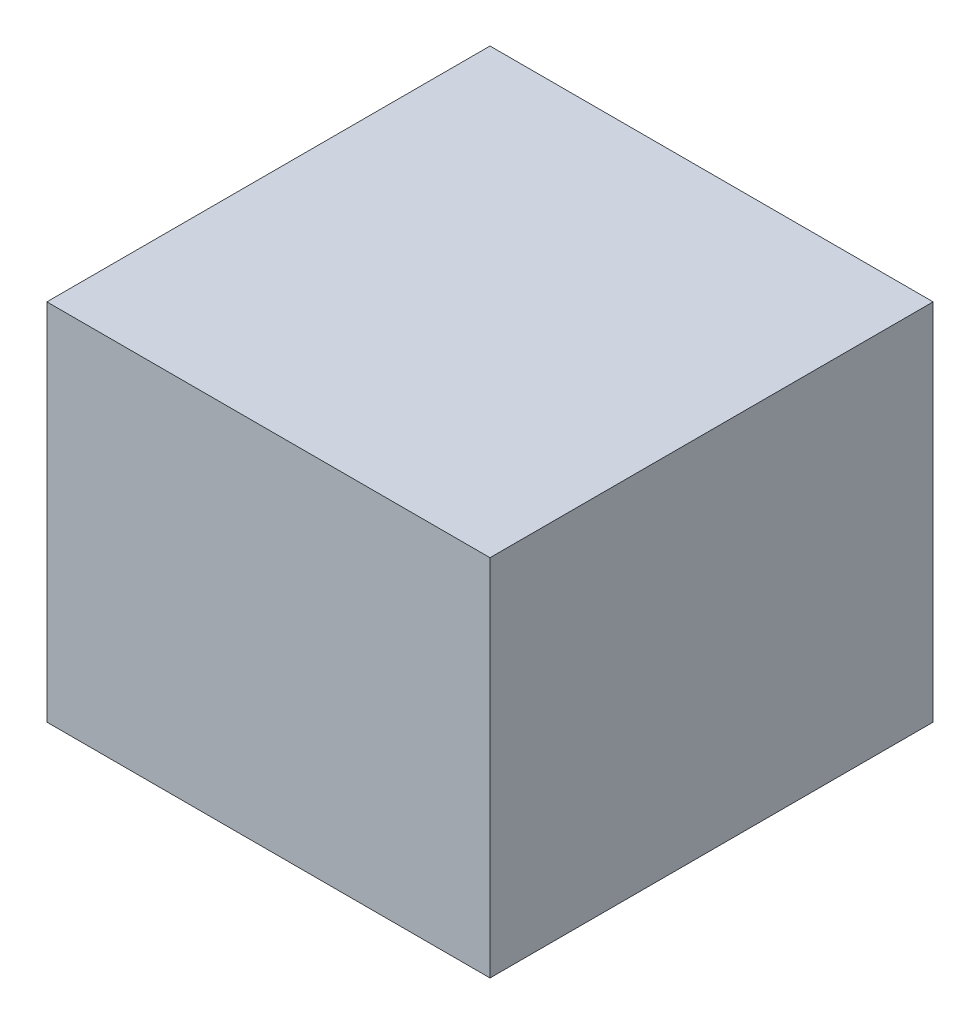
from build123d import *

# Parameters (mm, degrees)
SKETCH1_R           = 16
SKETCH1_R_2         = 6.25
BOSS_EXTRUDE1_DEPTH = 100
SKETCH2_W           = 40
SKETCH2_H           = 55
CUT_EXTRUDE1_DEPTH  = 20
SKETCH3_W           = 56
SKETCH3_H           = 46
BOSS_EXTRUDE2_DEPTH = 28
SKETCH4_R           = 8
BOSS_EXTRUDE3_DEPTH = 26


with BuildPart() as part:
    # Sketch1 → Boss-Extrude1 (new body)
    with BuildSketch(Plane(origin=(0, 0, 0), x_dir=(1, 0, 0), z_dir=(0, 1, 0))):
        with Locations(Location((0, 0, 0), (0, 0, 270))):
            Circle(SKETCH1_R)
        with Locations(Location((0, 0, 0), (0, 0, 270))):
            Circle(SKETCH1_R_2, mode=Mode.SUBTRACT)
    extrude(amount=BOSS_EXTRUDE1_DEPTH)

    # Sketch2 → Cut-Extrude1 (cut, symmetric)
    with BuildSketch(Plane.XY):
        with Locations((0, 25.5)):
            Rectangle(SKETCH2_W, SKETCH2_H)
    extrude(amount=CUT_EXTRUDE1_DEPTH, both=True, mode=Mode.SUBTRACT)

    # Sketch3 → Boss-Extrude2 (add, symmetric)
    with BuildSketch(Plane.XY):
        with Locations((0, 77)):
            Rectangle(SKETCH3_W, SKETCH3_H)
    extrude(amount=BOSS_EXTRUDE2_DEPTH, both=True)

    # Sketch4 → Boss-Extrude3 (add, symmetric)
    with BuildSketch(Plane.XY):
        with Locations((0, 76)):
            Circle(SKETCH4_R)
    extrude(amount=BOSS_EXTRUDE3_DEPTH, both=True)


solid = part.part
